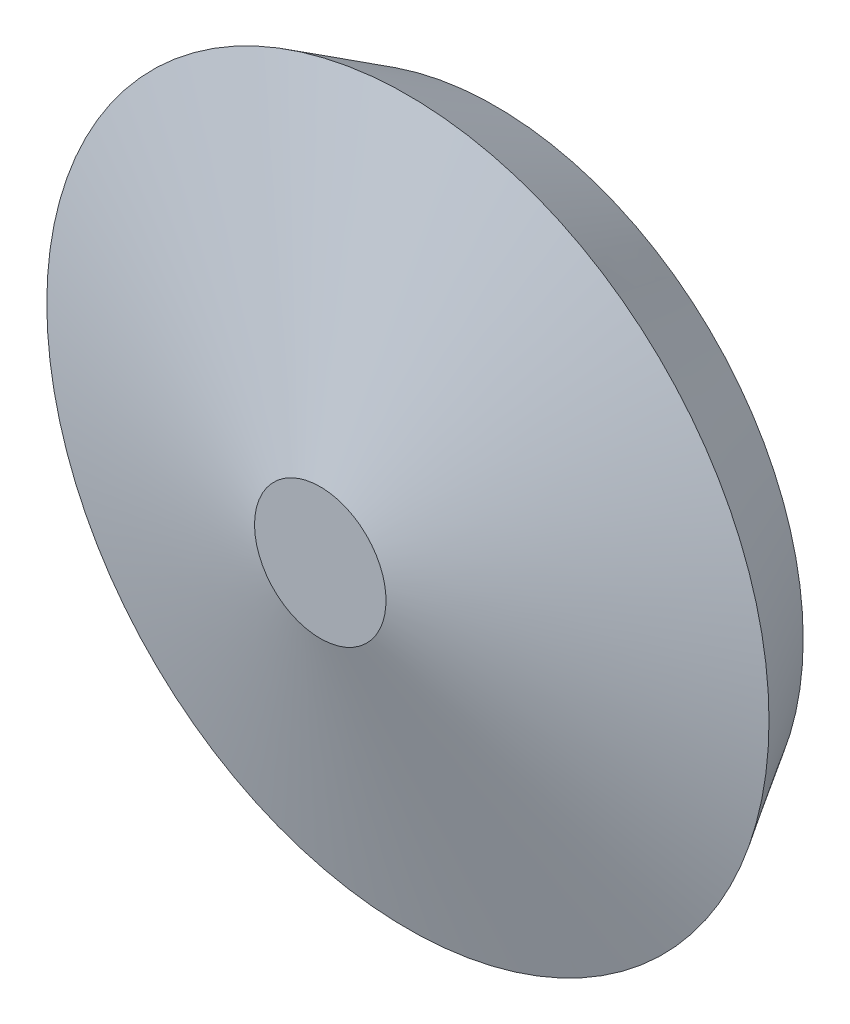
from build123d import *

# Parameters (mm, degrees)
SKETCH1_R = 175.5
SKETCH2_R = 206
SKETCH3_R = 37.5
SKETCH4_R = 206


with BuildPart() as part:
    # Sketch1 → Loft1 section 0
    with BuildSketch(Plane(origin=(0, 0, 0), x_dir=(0, 1, 0), z_dir=(0, 0, 1))):
        Circle(SKETCH1_R)
    # Sketch2 → Loft1 section 1
    with BuildSketch(Plane(origin=(0, 0, 50), x_dir=(0, 1, 0), z_dir=(0, 0, 1))):
        Circle(SKETCH2_R)
    loft()

    # Sketch3 → Loft4 section 0
    with BuildSketch(Plane(origin=(0, 0, 100), x_dir=(0, 1, 0), z_dir=(0, 0, 1))):
        Circle(SKETCH3_R)
    # Sketch4 → Loft4 section 1
    with BuildSketch(Plane.XY.offset(50)):
        Circle(SKETCH4_R)
    loft()


solid = part.part
